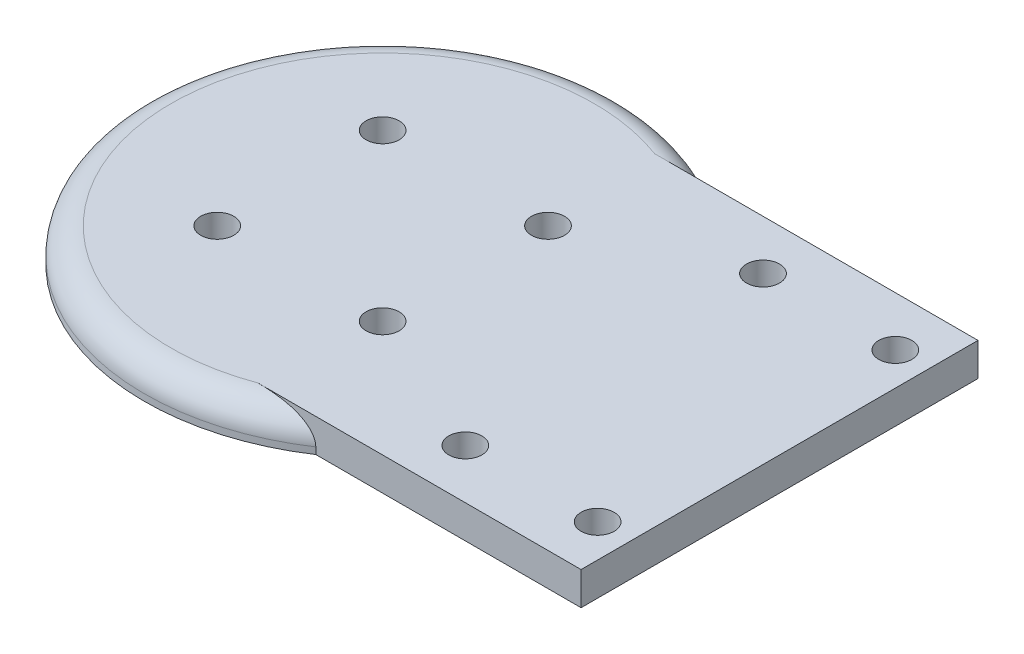
from build123d import *

# Parameters (mm, degrees)
EXTRUDE_1_DEPTH     = 5
FILLET_1_R          = 4
SKETCH_2_R          = 2.5
CUT_EXTRUDE_1_DEPTH = 71.149839773


with BuildPart() as part:
    # 草图1 → 凸台-拉伸1 (new body)
    with BuildSketch(Plane(origin=(0, 0, 0), x_dir=(1, 0, 0), z_dir=(0, 1, 0))):
        with BuildLine():
            Line((19.899748742, -30), (60, -30))
            Line((60, -30), (60, 30))
            Line((60, 30), (19.899748742, 30))
            ThreePointArc((19.899748742, 30), (-36, 0), (19.899748742, -30))
        make_face()
    extrude(amount=EXTRUDE_1_DEPTH)

    # 圆角1
    fillet_1_edges = [part.edges().sort_by_distance(p)[0] for p in [
        (-36, 5, 0),
    ]]
    fillet(fillet_1_edges, radius=FILLET_1_R)

    # 草图2 → 切除-拉伸1 (cut, through all)
    with BuildSketch(Plane(origin=(0, 5, 0), x_dir=(1, 0, 0), z_dir=(0, 1, 0))):
        with Locations(Location((-12.5, 12.5, 0), (0, 0, 270))):
            Circle(SKETCH_2_R)
        with Locations(Location((12.5, 12.5, 0), (0, 0, 270))):
            Circle(SKETCH_2_R)
        with Locations(Location((12.5, -12.5, 0), (0, 0, 270))):
            Circle(SKETCH_2_R)
        with Locations(Location((-12.5, -12.5, 0), (0, 0, 270))):
            Circle(SKETCH_2_R)
        with Locations(Location((35, 22.5, 0), (0, 0, 270))):
            Circle(SKETCH_2_R)
        with Locations(Location((55, 22.5, 0), (0, 0, 270))):
            Circle(SKETCH_2_R)
        with Locations(Location((55, -22.5, 0), (0, 0, 270))):
            Circle(SKETCH_2_R)
        with Locations(Location((35, -22.5, 0), (0, 0, 270))):
            Circle(SKETCH_2_R)
    extrude(amount=-CUT_EXTRUDE_1_DEPTH, mode=Mode.SUBTRACT)


solid = part.part
